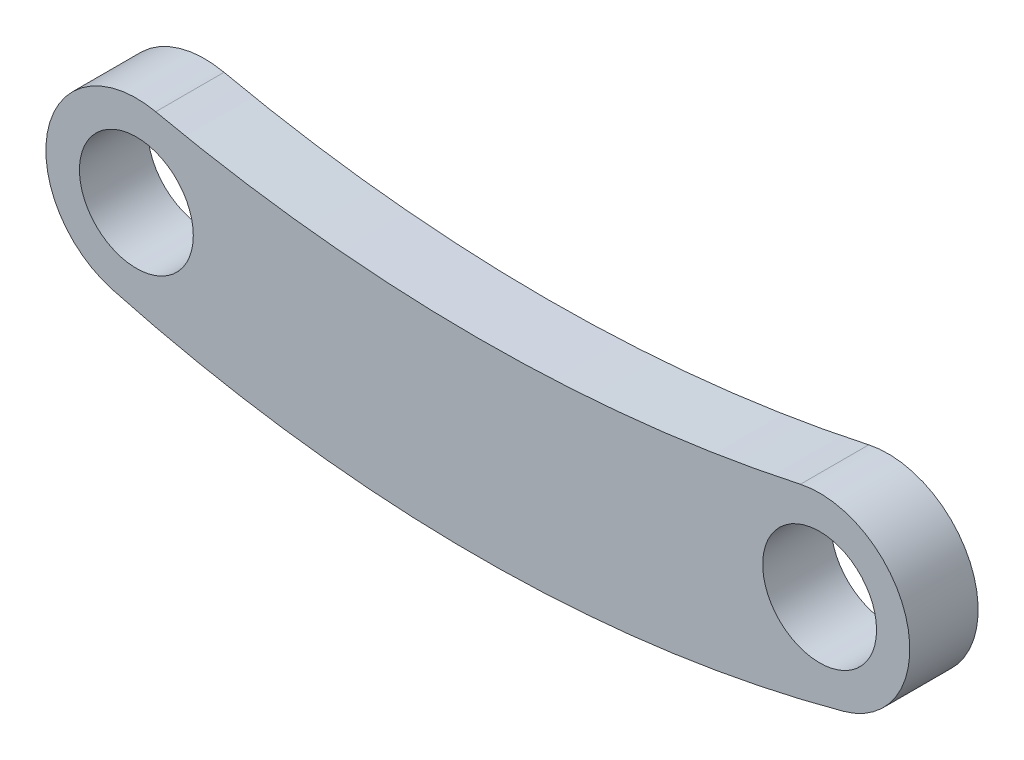
from build123d import *

# Parameters (mm, degrees)
SKETCH1_R           = 2.5
BOSS_EXTRUDE1_DEPTH = 3


with BuildPart() as part:
    # Sketch1 → Boss-Extrude1 (new body)
    with BuildSketch(Plane.XY):
        with BuildLine():
            ThreePointArc((-14.150756277, 3.881806405), (-18.86004326, 0.943240108), (-16.036680395, -3.836004383))
            ThreePointArc((-16.036680395, -3.836004383), (0.000803772, -5.961433764), (16.03648476, -3.822442478))
            ThreePointArc((16.03648476, -3.822442478), (18.847281854, 0.940100785), (14.156876957, 3.869691291))
            ThreePointArc((14.156876957, 3.869691291), (0.002406774, 2.348654926), (-14.150756277, 3.881806405))
        make_face()
        with Locations((-15, 0)):
            Circle(SKETCH1_R, mode=Mode.SUBTRACT)
        with Locations((15, 0)):
            Circle(SKETCH1_R, mode=Mode.SUBTRACT)
    extrude(amount=BOSS_EXTRUDE1_DEPTH)


solid = part.part
